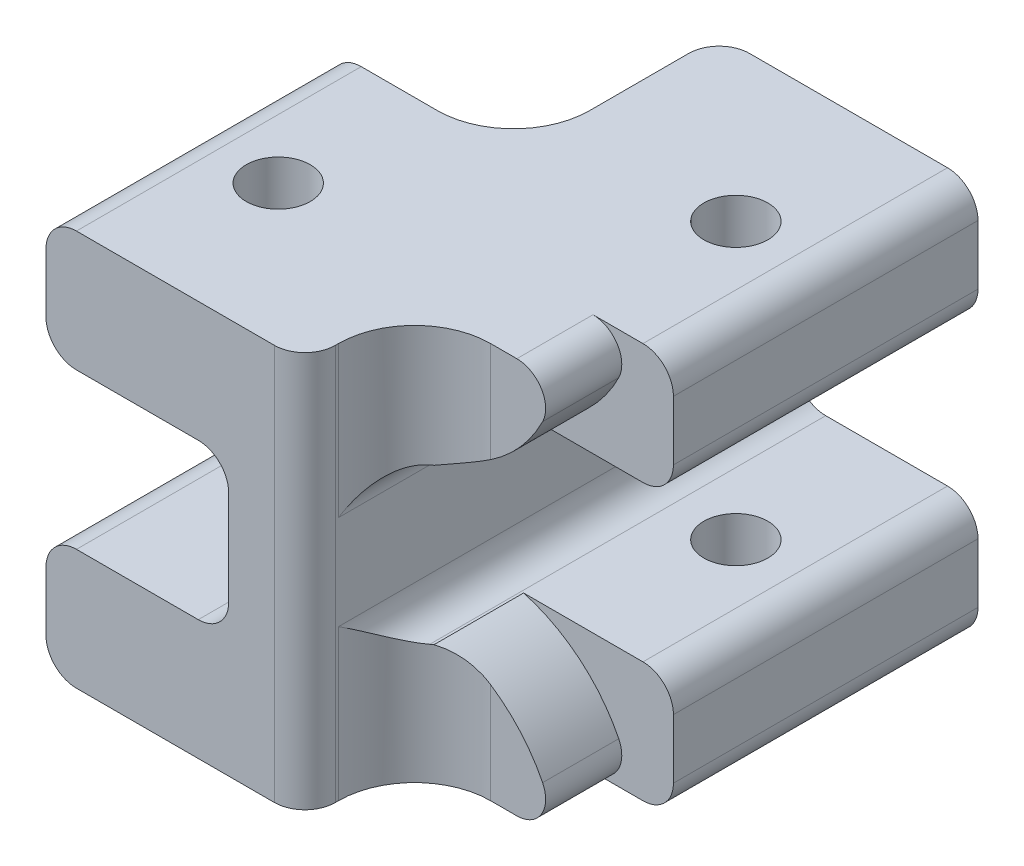
from build123d import *

# Parameters (mm, degrees)
SKETCH1_W                = 5
SKETCH1_H                = 26.000000000000004
BOSS_EXTRUDE1_DEPTH      = 20
BOSS_EXTRUDE3_DEPTH      = 12.2
BOSS_EXTRUDE3_DEPTH_BACK = 6.5
CUT_EXTRUDE2_DEPTH       = 38.6309712869599
CUT_EXTRUDE2_DEPTH_BACK  = 38.6309712869599
SKETCH4_R                = 2.100000000000001
FILLET5_R                = 2
FILLET7_R                = 2
BOSS_EXTRUDE5_START      = 5
BOSS_EXTRUDE5_DEPTH      = 5
FILLET15_R               = 5


with BuildPart() as part:
    # Sketch1 → Boss-Extrude1 (new body)
    with BuildSketch(Plane.XY):
        Rectangle(SKETCH1_W, SKETCH1_H)
        Polygon((14.5, 13), (2.5, 13), (2.5, 5.099999999999998), (14.500000000000004, 5.099999999999999), align=None)
        Polygon((14.500000000000004, -5.099999999999999), (2.500000000000007, -5.099999999999997), (2.5, -13), (14.5, -13), align=None)
    extrude(amount=BOSS_EXTRUDE1_DEPTH)

    # Sketch3 → Boss-Extrude3 (add, two sides: drawn at the far end of the back side and taken through both)
    with BuildSketch(Plane.XY.offset(20).offset(-BOSS_EXTRUDE3_DEPTH_BACK)):
        Polygon((2.5, 13), (-14.5, 13), (-14.500000000000004, 5.099999999999999), (-2.5, 5.099999999999998), (-2.5, -5.099999999999998), (-14.500000000000004, -5.099999999999999), (-14.5, -13), (2.5, -13), align=None)
    extrude(amount=BOSS_EXTRUDE3_DEPTH + BOSS_EXTRUDE3_DEPTH_BACK)

    # Sketch4 → Cut-Extrude2 (cut, two sides: drawn at the far end of the back side and taken through both)
    with BuildSketch(Plane(origin=(0, 0, 0), x_dir=(1, 0, 0), z_dir=(0, 1, 0)).offset(-CUT_EXTRUDE2_DEPTH_BACK)):
        with Locations(Location((8.6, -10, 0), (0, 0, 270))):
            Circle(SKETCH4_R)
        with Locations(Location((-8.6, -22.85, 0), (0, 0, 270))):
            Circle(SKETCH4_R)
    extrude(amount=CUT_EXTRUDE2_DEPTH + CUT_EXTRUDE2_DEPTH_BACK, mode=Mode.SUBTRACT)

    # Fillet5
    fillet5_edges = [part.edges().sort_by_distance(p)[0] for p in [
        (14.5, 13, 10),
        (14.500000000000004, 5.099999999999999, 10),
        (2.5000000000000036, 5.099999999999998, 10),
        (2.5000000000000036, -5.099999999999997, 10),
        (14.500000000000004, -5.099999999999999, 10),
        (14.5, -13, 10),
        (-2.5, 5.099999999999998, 22.85),
        (-14.5, -13, 22.85),
        (-14.5, 13, 22.85),
        (-14.500000000000004, 5.099999999999999, 22.85),
        (-2.5, -5.099999999999998, 22.85),
        (-14.500000000000004, -5.099999999999999, 22.85),
    ]]
    fillet(fillet5_edges, radius=FILLET5_R)

    # Fillet7
    fillet7_edges = [part.edges().sort_by_distance(p)[0] for p in [
        (-2.5, 0, 0),
        (2.5, 0, 32.2),
    ]]
    fillet(fillet7_edges, radius=FILLET7_R)

    # Sketch8 → Boss-Extrude5 (add)
    with BuildSketch(Plane.XY.offset(20).offset(BOSS_EXTRUDE5_START)):
        with BuildLine():
            Line((9.21850909129393, 13), (2.5, 13))
            Line((2.5, 13), (2.5, 3.099999999999998))
            ThreePointArc((2.5, 3.099999999999998), (3.085786437626906, 4.514213562373092), (4.500000000000001, 5.099999999999998))
            Line((4.500000000000001, 5.099999999999998), (4.662191244433229, 5.099999999999998))
            ThreePointArc((4.662191244433234, 5.099999999999962), (8.333268844866092, 7.021076435787774), (10.910532200315354, 10.265311171006154))
            ThreePointArc((10.910532200315352, 10.265311171006154), (10.826416519668328, 12.104060379927068), (9.21850909129393, 13))
        make_face()
        with BuildLine():
            ThreePointArc((4.500000000000001, -5.099999999999998), (3.085786437626905, -4.514213562373093), (2.5, -3.0999999999999974))
            Line((2.5, -3.099999999999998), (2.5, -13))
            Line((2.5, -13), (9.218509091293962, -13))
            ThreePointArc((9.218509091293962, -12.999999999999998), (10.8264165196684, -12.10406037992704), (10.910532200315423, -10.265311171006077))
            ThreePointArc((10.910532200315425, -10.265311171006077), (8.33326884486619, -7.021076435787755), (4.662191244433393, -5.099999999999964))
            Line((4.662191244433386, -5.099999999999998), (4.500000000000002, -5.099999999999998))
        make_face()
    extrude(amount=-BOSS_EXTRUDE5_DEPTH)

    # Fillet15
    fillet15_edges = [part.edges().sort_by_distance(p)[0] for p in [
        (-2.5, -8.049999999999999, 13.5),
        (-2.5, 8.049999999999999, 13.5),
        (2.5, -8.049999999999999, 25),
        (2.5, 8.049999999999999, 25),
    ]]
    fillet(fillet15_edges, radius=FILLET15_R)


solid = part.part
